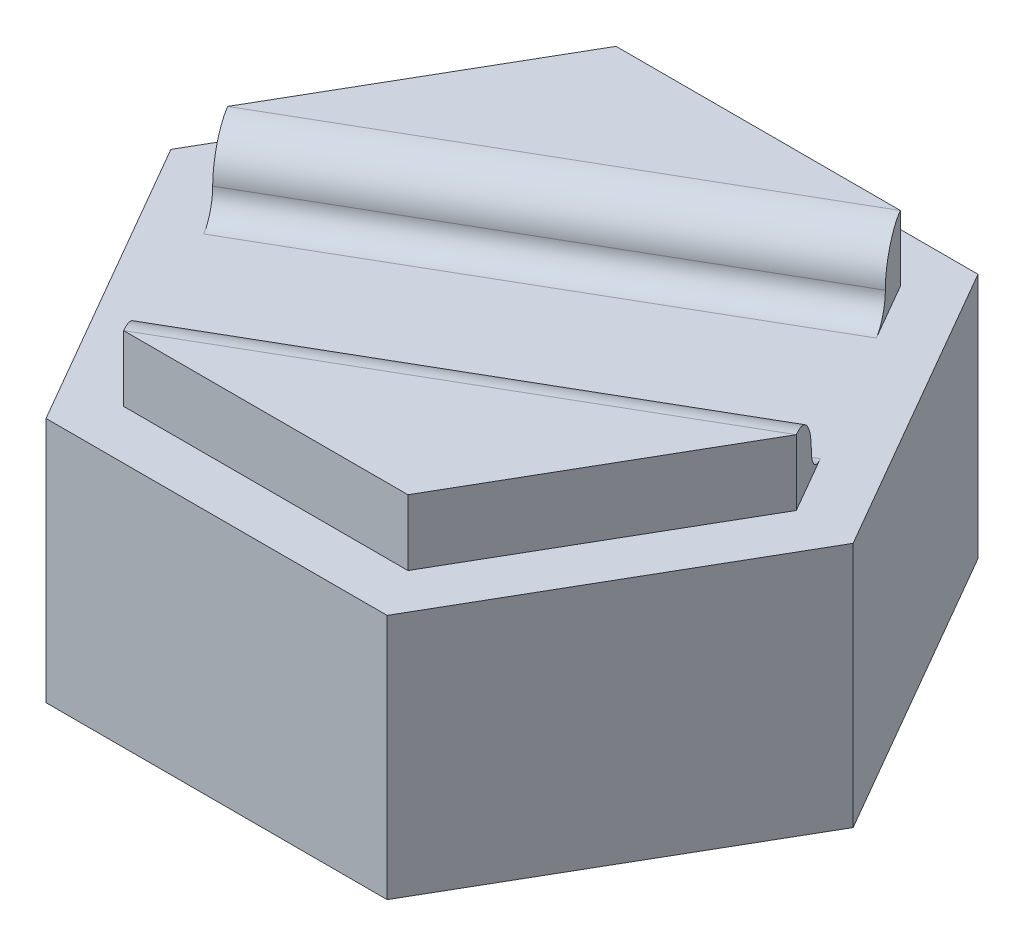
from build123d import *

# Parameters (mm, degrees)
BOSS_EXTRUDE1_DEPTH = 7.5
CUT_EXTRUDE1_DEPTH  = 2
BOSS_EXTRUDE2_DEPTH = 2
CUT_EXTRUDE2_DEPTH  = 15
SKETCH6_W           = 1
SKETCH6_H           = 1
CUT_EXTRUDE3_DEPTH  = 2
SKETCH7_W           = 0.5
SKETCH7_H           = 0.5
CUT_EXTRUDE4_DEPTH  = 1


with BuildPart() as part:
    # Sketch1 → Boss-Extrude1 (new body)
    # profile 1 of 2: a face of its own
    with BuildSketch(Plane(origin=(0, 0, 0), x_dir=(1, 0, 0), z_dir=(0, 1, 0))):
        Polygon((-5.196152423, -9), (5.196152423, -9), (10.392304845, 0), (5.196152423, 9), (-5.196152423, 9), (-10.392304845, 0), align=None)
        Polygon((4.330127019, -7.5), (8.660254038, 0), (4.330127019, 7.5), (-4.330127019, 7.5), (-8.660254038, 0), (-4.330127019, -7.5), align=None, mode=Mode.SUBTRACT)
    # profile 2 of 2: a face of its own
    with BuildSketch(Plane(origin=(0, 0, 0), x_dir=(1, 0, 0), z_dir=(0, 1, 0))):
        Polygon((-4.330127019, -7.5), (4.330127019, -7.5), (8.660254038, 0), (4.330127019, 7.5), (-4.330127019, 7.5), (-8.660254038, 0), align=None)
    extrude(amount=BOSS_EXTRUDE1_DEPTH)

    # Sketch1<3> → Cut-Extrude1 (cut)
    with BuildSketch(Plane(origin=(0, 0, 0), x_dir=(1, 0, 0), z_dir=(0, 1, 0))):
        Polygon((-4.330127019, -7.5), (4.330127019, -7.5), (8.660254038, 0), (4.330127019, 7.5), (-4.330127019, 7.5), (-8.660254038, 0), align=None)
    extrude(amount=CUT_EXTRUDE1_DEPTH, mode=Mode.SUBTRACT)

    # Sketch4 → Boss-Extrude2 (add)
    with BuildSketch(Plane(origin=(0, 7.5, 0), x_dir=(1, 0, 0), z_dir=(0, 1, 0))):
        Polygon((8.660254038, 0), (4.330127019, 7.5), (-4.330127019, 7.5), (-8.660254038, 0), (-4.330127019, -7.5), (4.330127019, -7.5), align=None)
    extrude(amount=BOSS_EXTRUDE2_DEPTH)

    # Sketch5 → Cut-Extrude2 (cut)
    with BuildSketch(Plane(origin=(-6.495190528, 0, 3.75), x_dir=(0.5000000000000006, 0, 0.8660254037844384), z_dir=(-0.8660254037844384, 0, 0.5000000000000006))):
        with BuildLine():
            ThreePointArc((-3.080127019, 8.25), (-2.860457105, 7.719669914), (-2.330127019, 7.5))
            Line((-2.330127019, 7.5), (2.330127019, 7.5))
            ThreePointArc((2.330127019, 7.5), (2.860457105, 7.719669914), (3.080127019, 8.25))
            ThreePointArc((3.080127019, 8.25), (3.446243542, 9.133883476), (4.330127019, 9.5))
            Line((4.330127019, 9.5), (-4.330127019, 9.5))
            ThreePointArc((-4.330127019, 9.5), (-3.446243542, 9.133883476), (-3.080127019, 8.25))
        make_face()
    extrude(amount=-CUT_EXTRUDE2_DEPTH, mode=Mode.SUBTRACT)

    # Sketch6 → Cut-Extrude3 (cut)
    with BuildSketch(Plane(origin=(-7.794228634, 0, 4.5), x_dir=(0.5000000000000071, 0, 0.8660254037844346), z_dir=(-0.8660254037844345, 0, 0.500000000000007))):
        with Locations((-3.830127019, 4.273741672)):
            Rectangle(SKETCH6_W, SKETCH6_H)
    cut_extrude3 = extrude(amount=-CUT_EXTRUDE3_DEPTH, mode=Mode.SUBTRACT)

    # Sketch7 → Cut-Extrude4 (cut)
    with BuildSketch(Plane(origin=(-2.165063509, 0, -3.75), x_dir=(0.8660254037844346, 0, -0.5000000000000071), z_dir=(0.5000000000000071, 0, 0.8660254037844346))):
        with Locations((-7.25, 3.523741672)):
            Rectangle(SKETCH7_W, SKETCH7_H)
    cut_extrude4 = extrude(amount=CUT_EXTRUDE4_DEPTH, mode=Mode.SUBTRACT)

    # Mirror1: Cut-Extrude3, Cut-Extrude4 across plane
    add(cut_extrude3.mirror(Plane(origin=(0, 0, 0), x_dir=(-0.8660254037844349, 0, 0.5000000000000067), z_dir=(-0.500000000000007, 0, -0.8660254037844347))), mode=Mode.SUBTRACT)
    add(cut_extrude4.mirror(Plane(origin=(0, 0, 0), x_dir=(-0.8660254037844349, 0, 0.5000000000000067), z_dir=(-0.500000000000007, 0, -0.8660254037844347))), mode=Mode.SUBTRACT)


solid = part.part
